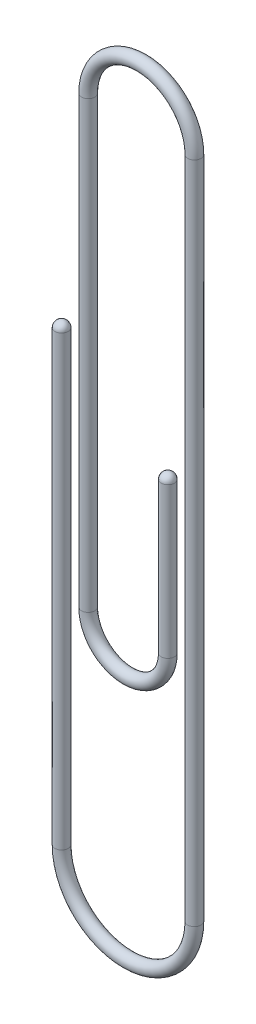
from build123d import *

# Parameters (mm, degrees)
BARRER1_PROFILE_R = 0.5
REDONDEO1_R       = 0.5
REDONDEO2_R       = 0.5


with BuildPart() as part:
    # Barrer1: sweep along a path in Croquis2
    with BuildLine(Plane.XY) as barrer1_path:
        Line((-2, -20.026919646), (-2, -31.853401443))
        ThreePointArc((-2, -31.853401443), (-5, -34.853401443), (-8, -31.853401443))
        Line((-8, -31.853401443), (-8, 1.651570193))
        ThreePointArc((-8, 1.651570193), (-4, 5.651570193), (0, 1.651570193))
        Line((0, 1.651570193), (0, -48.348429807))
        ThreePointArc((0, -48.348429807), (-5, -53.348429807), (-10, -48.348429807))
        Line((-10, -48.348429807), (-10, -14.134208692))
    # Barrer1 profile (on start of the path) → Barrer1 (sweep)
    with BuildSketch(Plane(origin=(-2, -20.026919646, 0), x_dir=(0, 0, -1), z_dir=(0, -1, 0))):
        Circle(BARRER1_PROFILE_R)
    sweep(path=barrer1_path.line)

    # Redondeo1
    redondeo1_edges = [part.edges().sort_by_distance(p)[0] for p in [
        (-2, -20.026919646, 0.5),
    ]]
    fillet(redondeo1_edges, radius=REDONDEO1_R)

    # Redondeo2
    redondeo2_edges = [part.edges().sort_by_distance(p)[0] for p in [
        (-10, -14.134208692, 0.5),
    ]]
    fillet(redondeo2_edges, radius=REDONDEO2_R)


solid = part.part
